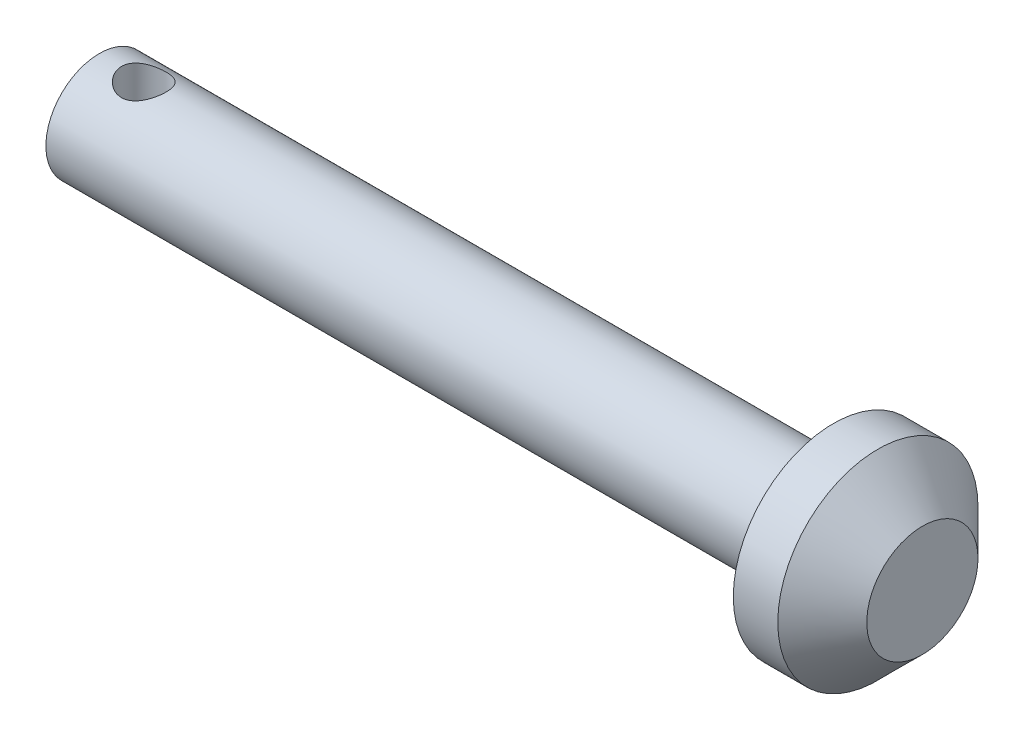
from build123d import *

# Parameters (mm, degrees)
DODANIE_WYCI_GNI_CIE1_DEPTH      = 5
DODANIE_WYCI_GNI_CIE1_DEPTH_BACK = 28
SZKIC1_R                         = 2.4
SZKIC2_R                         = 4.5
DODANIE_WYCI_GNI_CIE2_DEPTH      = 4
SFAZOWANIE1_SIZE                 = 2
WYTNIJ_WYCI_GNI_CIE1_DEPTH       = 29.714108031
WYTNIJ_WYCI_GNI_CIE1_DEPTH_BACK  = 29.714108031
SZKIC3_R                         = 1


with BuildPart() as part:
    # Szkic1 → Dodanie-wyciągnięcie1 (new, two sides: drawn at the far end of the back side and taken through both)
    with BuildSketch(Plane(origin=(0, 0, 0), x_dir=(0, 0, -1), z_dir=(1, 0, 0)).offset(-DODANIE_WYCI_GNI_CIE1_DEPTH_BACK)):
        Circle(SZKIC1_R)
    extrude(amount=DODANIE_WYCI_GNI_CIE1_DEPTH + DODANIE_WYCI_GNI_CIE1_DEPTH_BACK)

    # Szkic2 → Dodanie-wyciągnięcie2 (add)
    with BuildSketch(Plane(origin=(5, 0, 0), x_dir=(0, 0, -1), z_dir=(1, 0, 0))):
        Circle(SZKIC2_R)
    extrude(amount=DODANIE_WYCI_GNI_CIE2_DEPTH)

    # Sfazowanie1
    sfazowanie1_edges = [part.edges().sort_by_distance(p)[0] for p in [
        (9, 0, 4.5),
    ]]
    chamfer(sfazowanie1_edges, length=SFAZOWANIE1_SIZE)

    # Szkic3 → Wytnij-wyciągnięcie1 (cut, two sides: drawn at the far end of the back side and taken through both)
    with BuildSketch(Plane(origin=(0, 0, 0), x_dir=(1, 0, 0), z_dir=(0, 1, 0)).offset(-WYTNIJ_WYCI_GNI_CIE1_DEPTH_BACK)):
        with Locations(Location((-26, 0, 0), (0, 0, 270))):
            Circle(SZKIC3_R)
    extrude(amount=WYTNIJ_WYCI_GNI_CIE1_DEPTH + WYTNIJ_WYCI_GNI_CIE1_DEPTH_BACK, mode=Mode.SUBTRACT)


solid = part.part
